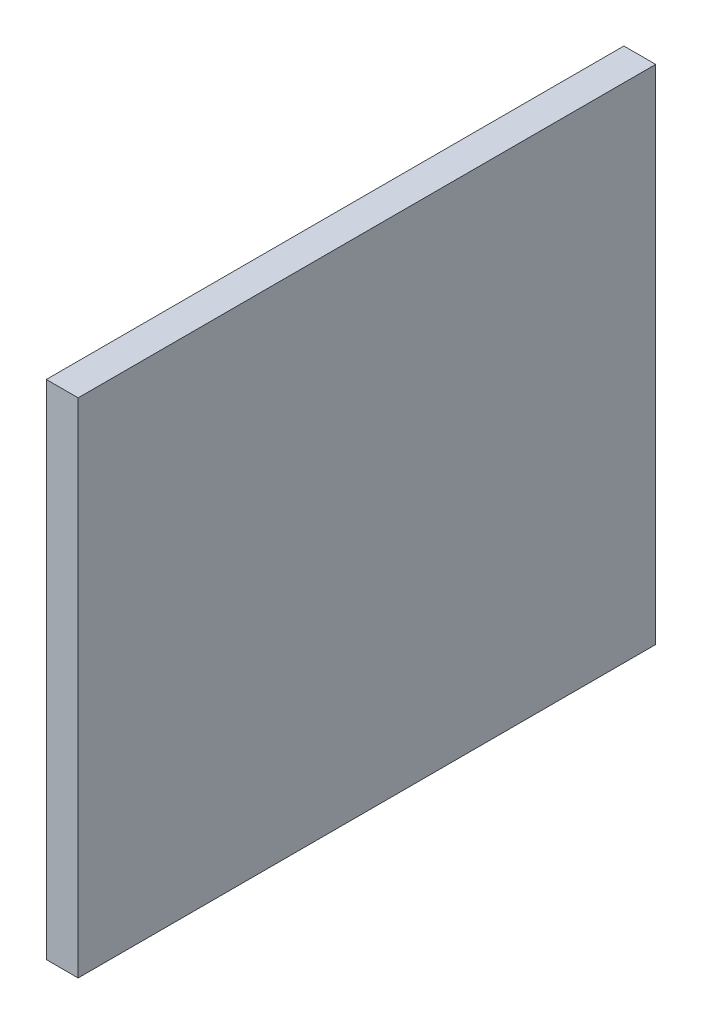
from build123d import *

# Parameters (mm, degrees)
SKETCH1_W           = 3.175
SKETCH1_H           = 50.1142
BOSS_EXTRUDE1_DEPTH = 57.6072


with BuildPart() as part:
    # Sketch1 → Boss-Extrude1 (new body)
    with BuildSketch(Plane.XY):
        with Locations((7623.56112852, 3335.512039602)):
            Rectangle(SKETCH1_W, SKETCH1_H)
    extrude(amount=BOSS_EXTRUDE1_DEPTH)


solid = part.part
